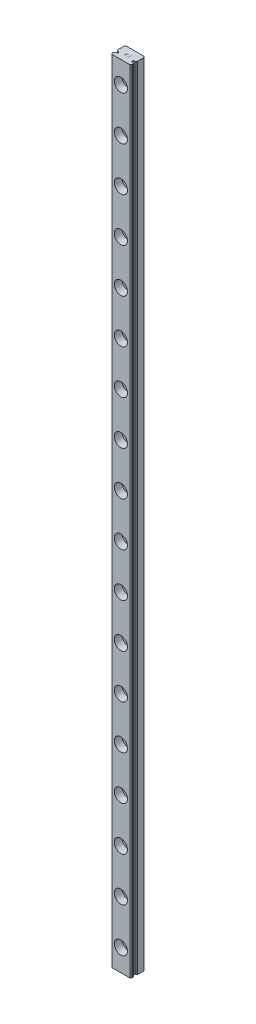
from build123d import *

# Parameters (mm, degrees)
SALIENTE_EXTRUIR1_DEPTH               = 360
CORTAR_EXTRUIR1_DEPTH                 = 361.086795093
CORTAR_EXTRUIR2_DEPTH                 = 361.086795093
CORTAR_EXTRUIR3_DEPTH                 = 361.086795093
CORTAR_EXTRUIR4_DEPTH                 = 361.086795093
CORTAR_EXTRUIR5_DEPTH                 = 361.086795093
CORTAR_EXTRUIR6_DEPTH                 = 361.086795093
CORTAR_EXTRUIR7_DEPTH                 = 0.002166667
CORTAR_EXTRUIR8_DEPTH                 = 0.002166667
CORTAR_EXTRUIR9_DEPTH                 = 0.002166667
CORTAR_EXTRUIR10_DEPTH                = 0.002166667
NGULO_DE_SALIDA1_ANGLE                = 45.1469538
TALADRO_ROSCADO_M3_5X0_61_AT_2_COUNT  = 2
TALADRO_ROSCADO_M3_5X0_61_AT_2_PITCH  = 20
TALADRO_ROSCADO_M3_5X0_61_AT_3_COUNT  = 2
TALADRO_ROSCADO_M3_5X0_61_AT_3_PITCH  = 40
TALADRO_ROSCADO_M3_5X0_61_AT_4_COUNT  = 2
TALADRO_ROSCADO_M3_5X0_61_AT_4_PITCH  = 60
TALADRO_ROSCADO_M3_5X0_61_AT_5_COUNT  = 2
TALADRO_ROSCADO_M3_5X0_61_AT_5_PITCH  = 80
TALADRO_ROSCADO_M3_5X0_61_AT_6_COUNT  = 2
TALADRO_ROSCADO_M3_5X0_61_AT_6_PITCH  = 100
TALADRO_ROSCADO_M3_5X0_61_AT_7_COUNT  = 2
TALADRO_ROSCADO_M3_5X0_61_AT_7_PITCH  = 120
TALADRO_ROSCADO_M3_5X0_61_AT_8_COUNT  = 2
TALADRO_ROSCADO_M3_5X0_61_AT_8_PITCH  = 140
TALADRO_ROSCADO_M3_5X0_61_AT_9_COUNT  = 2
TALADRO_ROSCADO_M3_5X0_61_AT_9_PITCH  = 160
TALADRO_ROSCADO_M3_5X0_61_AT_10_COUNT = 2
TALADRO_ROSCADO_M3_5X0_61_AT_10_PITCH = 180
TALADRO_ROSCADO_M3_5X0_61_AT_11_COUNT = 2
TALADRO_ROSCADO_M3_5X0_61_AT_11_PITCH = 200
TALADRO_ROSCADO_M3_5X0_61_AT_12_COUNT = 2
TALADRO_ROSCADO_M3_5X0_61_AT_12_PITCH = 220
TALADRO_ROSCADO_M3_5X0_61_AT_13_COUNT = 2
TALADRO_ROSCADO_M3_5X0_61_AT_13_PITCH = 240
TALADRO_ROSCADO_M3_5X0_61_AT_14_COUNT = 2
TALADRO_ROSCADO_M3_5X0_61_AT_14_PITCH = 260
TALADRO_ROSCADO_M3_5X0_61_AT_15_COUNT = 2
TALADRO_ROSCADO_M3_5X0_61_AT_15_PITCH = 280
TALADRO_ROSCADO_M3_5X0_61_AT_16_COUNT = 2
TALADRO_ROSCADO_M3_5X0_61_AT_16_PITCH = 300
TALADRO_ROSCADO_M3_5X0_61_AT_17_COUNT = 2
TALADRO_ROSCADO_M3_5X0_61_AT_17_PITCH = 320
TALADRO_ROSCADO_M3_5X0_61_AT_18_COUNT = 2
TALADRO_ROSCADO_M3_5X0_61_AT_18_PITCH = 20
CHAFL_N1_SIZE                         = 0.4
REDONDEO1_R                           = 0.130000023
CUT_EXTRUDE1_START                    = -3
SKETCH1_R                             = 3
CUT_EXTRUDE1_DEPTH                    = 3


with BuildPart() as part:
    # Croquis1 → Saliente-Extruir1 (new body)
    with BuildSketch(Plane.XZ):
        Polygon((4.5, 0), (4.5, 6.01167813), (4.1, 6.50000002), (-4.1, 6.50000002), (-4.5, 6.01167813), (-4.5, 0), align=None)
    extrude(amount=-SALIENTE_EXTRUIR1_DEPTH)

    # Croquis2 → Cortar-Extruir1 (cut, through all)
    with BuildSketch(Plane(origin=(0, 360, 0), x_dir=(-1, 0, 0), z_dir=(0, 1, 0))):
        with BuildLine():
            Line((-4.5, 4.88017535), (-4.5, 4.03150278))
            Line((-4.5, 4.03150278), (-3.819258765, 4.03150278))
            ThreePointArc((-3.819258765, 4.03150278), (-3.21946318, 4.455839065), (-3.819258765, 4.88017535))
            Line((-3.819258765, 4.88017535), (-4.5, 4.88017535))
        make_face()
    extrude(amount=-CORTAR_EXTRUIR1_DEPTH, mode=Mode.SUBTRACT)

    # Croquis3 → Cortar-Extruir2 (cut, through all)
    with BuildSketch(Plane(origin=(0, 360, 0), x_dir=(-1, 0, 0), z_dir=(0, 1, 0))):
        with BuildLine():
            Line((-4.026513856, 4.03150278), (-4.5, 4.03150278))
            Line((-4.5, 4.03150278), (-4.5, 3.583620931))
            ThreePointArc((-4.5, 3.583620931), (-4.223645982, 3.76568645), (-4.026513856, 4.03150278))
        make_face()
    extrude(amount=-CORTAR_EXTRUIR2_DEPTH, mode=Mode.SUBTRACT)

    # Croquis4 → Cortar-Extruir3 (cut, through all)
    with BuildSketch(Plane(origin=(0, 360, 0), x_dir=(-1, 0, 0), z_dir=(0, 1, 0))):
        with BuildLine():
            Line((-4.5, 5.328056964), (-4.5, 4.88017535))
            Line((-4.5, 4.88017535), (-4.026513974, 4.88017535))
            ThreePointArc((-4.026513974, 4.88017535), (-4.223646078, 5.145991535), (-4.5, 5.328056964))
        make_face()
    extrude(amount=-CORTAR_EXTRUIR3_DEPTH, mode=Mode.SUBTRACT)

    # Croquis5 → Cortar-Extruir4 (cut, through all)
    with BuildSketch(Plane(origin=(0, 360, 0), x_dir=(-1, 0, 0), z_dir=(0, 1, 0))):
        with BuildLine():
            Line((4.5, 4.03150278), (4.5, 4.88017535))
            Line((4.5, 4.88017535), (3.819258765, 4.88017535))
            ThreePointArc((3.819258765, 4.88017535), (3.21946318, 4.455839065), (3.819258765, 4.03150278))
            Line((3.819258765, 4.03150278), (4.5, 4.03150278))
        make_face()
    extrude(amount=-CORTAR_EXTRUIR4_DEPTH, mode=Mode.SUBTRACT)

    # Croquis6 → Cortar-Extruir5 (cut, through all)
    with BuildSketch(Plane(origin=(0, 360, 0), x_dir=(-1, 0, 0), z_dir=(0, 1, 0))):
        with BuildLine():
            Line((4.026513826, 4.88017535), (4.5, 4.88017535))
            Line((4.5, 4.88017535), (4.5, 5.328057255))
            ThreePointArc((4.5, 5.328057255), (4.223645966, 5.145991706), (4.026513826, 4.88017535))
        make_face()
    extrude(amount=-CORTAR_EXTRUIR5_DEPTH, mode=Mode.SUBTRACT)

    # Croquis7 → Cortar-Extruir6 (cut, through all)
    with BuildSketch(Plane(origin=(0, 360, 0), x_dir=(-1, 0, 0), z_dir=(0, 1, 0))):
        with BuildLine():
            Line((4.5, 3.583620926), (4.5, 4.03150278))
            Line((4.5, 4.03150278), (4.026513851, 4.03150278))
            ThreePointArc((4.026513851, 4.03150278), (4.223645987, 3.765686455), (4.5, 3.583620926))
        make_face()
    extrude(amount=-CORTAR_EXTRUIR6_DEPTH, mode=Mode.SUBTRACT)

    # Croquis8 → Cortar-Extruir7 (cut)
    with BuildSketch(Plane(origin=(0, 360, 0), x_dir=(-1, 0, 0), z_dir=(0, 1, 0))):
        Polygon((0.891369267, 3.403698133), (0.714701433, 3.168235633), (0.2187042, 2.61105), (1.0945792, 2.61105), (1.0945792, 2.695983333), (0.398689633, 2.695983333), (0.794326433, 3.149466667), (0.9743123, 3.3891), (1.067110588, 3.573407857), (0.95413722, 3.802321701), (0.7876908, 3.88505), (0.54301, 3.88505), (0.375434678, 3.803592619), (0.295011167, 3.6384023), (0.295011167, 3.562), (0.3812718, 3.562), (0.3812718, 3.631766667), (0.437672733, 3.743620833), (0.549645633, 3.800116667), (0.7802262, 3.800116667), (0.893028067, 3.743810633), (0.976240026, 3.576039029), align=None)
    extrude(amount=-CORTAR_EXTRUIR7_DEPTH, mode=Mode.SUBTRACT)

    # Croquis9 → Cortar-Extruir8 (cut)
    with BuildSketch(Plane.XZ):
        Polygon((-0.214632167, 3.88505), (-0.953983333, 3.88505), (-0.953983333, 2.61105), (-0.214632167, 2.61105), (-0.214632167, 2.695983333), (-0.86905, 2.695983333), (-0.86905, 3.205583333), (-0.5123963, 3.205583333), (-0.5123963, 3.290516667), (-0.86905, 3.290516667), (-0.86905, 3.800116667), (-0.214632167, 3.800116667), align=None)
    extrude(amount=-CORTAR_EXTRUIR8_DEPTH, mode=Mode.SUBTRACT)

    # Croquis10 → Cortar-Extruir9 (cut)
    with BuildSketch(Plane(origin=(0, 360, 0), x_dir=(-1, 0, 0), z_dir=(0, 1, 0))):
        Polygon((-0.214632167, 3.88505), (-0.953983333, 3.88505), (-0.953983333, 2.61105), (-0.214632167, 2.61105), (-0.214632167, 2.695983333), (-0.86905, 2.695983333), (-0.86905, 3.205583333), (-0.5123963, 3.205583333), (-0.5123963, 3.290516667), (-0.86905, 3.290516667), (-0.86905, 3.800116667), (-0.214632167, 3.800116667), align=None)
    extrude(amount=-CORTAR_EXTRUIR9_DEPTH, mode=Mode.SUBTRACT)

    # Croquis11 → Cortar-Extruir10 (cut)
    with BuildSketch(Plane.XZ):
        Polygon((0.510057167, 3.620830633), (0.6071, 3.718655633), (0.6071, 2.609403333), (0.692033333, 2.609403333), (0.692033333, 3.883403333), (0.6741176, 3.883403333), (0.6741176, 3.795069794), (0.3690544, 3.640736667), (0.3690544, 3.551253333), align=None)
    extrude(amount=-CORTAR_EXTRUIR10_DEPTH, mode=Mode.SUBTRACT)

    # Ángulo de salida1
    ngulo_de_salida1_faces = [part.faces().sort_by_distance(p)[0] for p in [
        (0.6741176, 0.001083333, 3.839236564),
    ]]
    draft(ngulo_de_salida1_faces, Plane(origin=(0.692033333, 0.002166667, 3.883403333), x_dir=(-1, 0, 0), z_dir=(0, 0, -1)), NGULO_DE_SALIDA1_ANGLE)

    # Croquis34 → Taladro roscado M3.5x0.61 (revolve, cut)
    with BuildSketch(Plane(origin=(0, 330, 0), x_dir=(0, 1, 0), z_dir=(1, 0, 0))):
        Polygon((0, 0), (0, 6.09), (3, 6.09), (3, 3), (1.75, 3), (1.75, 0), align=None)
    taladro_roscado_m3_5x0_61 = revolve(axis=Axis((0, 330, -6.35), (0, 0, 1)), mode=Mode.SUBTRACT)

    # Taladro roscado M3.5x0.61 at 2: Taladro roscado M3.5x0.61 ×2
    with Locations(*[(0, -i * TALADRO_ROSCADO_M3_5X0_61_AT_2_PITCH, 0) for i in range(1, TALADRO_ROSCADO_M3_5X0_61_AT_2_COUNT)]):
        add(taladro_roscado_m3_5x0_61, mode=Mode.SUBTRACT)

    # Taladro roscado M3.5x0.61 at 3: Taladro roscado M3.5x0.61 ×2
    with Locations(*[(0, -i * TALADRO_ROSCADO_M3_5X0_61_AT_3_PITCH, 0) for i in range(1, TALADRO_ROSCADO_M3_5X0_61_AT_3_COUNT)]):
        add(taladro_roscado_m3_5x0_61, mode=Mode.SUBTRACT)

    # Taladro roscado M3.5x0.61 at 4: Taladro roscado M3.5x0.61 ×2
    with Locations(*[(0, -i * TALADRO_ROSCADO_M3_5X0_61_AT_4_PITCH, 0) for i in range(1, TALADRO_ROSCADO_M3_5X0_61_AT_4_COUNT)]):
        add(taladro_roscado_m3_5x0_61, mode=Mode.SUBTRACT)

    # Taladro roscado M3.5x0.61 at 5: Taladro roscado M3.5x0.61 ×2
    with Locations(*[(0, -i * TALADRO_ROSCADO_M3_5X0_61_AT_5_PITCH, 0) for i in range(1, TALADRO_ROSCADO_M3_5X0_61_AT_5_COUNT)]):
        add(taladro_roscado_m3_5x0_61, mode=Mode.SUBTRACT)

    # Taladro roscado M3.5x0.61 at 6: Taladro roscado M3.5x0.61 ×2
    with Locations(*[(0, -i * TALADRO_ROSCADO_M3_5X0_61_AT_6_PITCH, 0) for i in range(1, TALADRO_ROSCADO_M3_5X0_61_AT_6_COUNT)]):
        add(taladro_roscado_m3_5x0_61, mode=Mode.SUBTRACT)

    # Taladro roscado M3.5x0.61 at 7: Taladro roscado M3.5x0.61 ×2
    with Locations(*[(0, -i * TALADRO_ROSCADO_M3_5X0_61_AT_7_PITCH, 0) for i in range(1, TALADRO_ROSCADO_M3_5X0_61_AT_7_COUNT)]):
        add(taladro_roscado_m3_5x0_61, mode=Mode.SUBTRACT)

    # Taladro roscado M3.5x0.61 at 8: Taladro roscado M3.5x0.61 ×2
    with Locations(*[(0, -i * TALADRO_ROSCADO_M3_5X0_61_AT_8_PITCH, 0) for i in range(1, TALADRO_ROSCADO_M3_5X0_61_AT_8_COUNT)]):
        add(taladro_roscado_m3_5x0_61, mode=Mode.SUBTRACT)

    # Taladro roscado M3.5x0.61 at 9: Taladro roscado M3.5x0.61 ×2
    with Locations(*[(0, -i * TALADRO_ROSCADO_M3_5X0_61_AT_9_PITCH, 0) for i in range(1, TALADRO_ROSCADO_M3_5X0_61_AT_9_COUNT)]):
        add(taladro_roscado_m3_5x0_61, mode=Mode.SUBTRACT)

    # Taladro roscado M3.5x0.61 at 10: Taladro roscado M3.5x0.61 ×2
    with Locations(*[(0, -i * TALADRO_ROSCADO_M3_5X0_61_AT_10_PITCH, 0) for i in range(1, TALADRO_ROSCADO_M3_5X0_61_AT_10_COUNT)]):
        add(taladro_roscado_m3_5x0_61, mode=Mode.SUBTRACT)

    # Taladro roscado M3.5x0.61 at 11: Taladro roscado M3.5x0.61 ×2
    with Locations(*[(0, -i * TALADRO_ROSCADO_M3_5X0_61_AT_11_PITCH, 0) for i in range(1, TALADRO_ROSCADO_M3_5X0_61_AT_11_COUNT)]):
        add(taladro_roscado_m3_5x0_61, mode=Mode.SUBTRACT)

    # Taladro roscado M3.5x0.61 at 12: Taladro roscado M3.5x0.61 ×2
    with Locations(*[(0, -i * TALADRO_ROSCADO_M3_5X0_61_AT_12_PITCH, 0) for i in range(1, TALADRO_ROSCADO_M3_5X0_61_AT_12_COUNT)]):
        add(taladro_roscado_m3_5x0_61, mode=Mode.SUBTRACT)

    # Taladro roscado M3.5x0.61 at 13: Taladro roscado M3.5x0.61 ×2
    with Locations(*[(0, -i * TALADRO_ROSCADO_M3_5X0_61_AT_13_PITCH, 0) for i in range(1, TALADRO_ROSCADO_M3_5X0_61_AT_13_COUNT)]):
        add(taladro_roscado_m3_5x0_61, mode=Mode.SUBTRACT)

    # Taladro roscado M3.5x0.61 at 14: Taladro roscado M3.5x0.61 ×2
    with Locations(*[(0, -i * TALADRO_ROSCADO_M3_5X0_61_AT_14_PITCH, 0) for i in range(1, TALADRO_ROSCADO_M3_5X0_61_AT_14_COUNT)]):
        add(taladro_roscado_m3_5x0_61, mode=Mode.SUBTRACT)

    # Taladro roscado M3.5x0.61 at 15: Taladro roscado M3.5x0.61 ×2
    with Locations(*[(0, -i * TALADRO_ROSCADO_M3_5X0_61_AT_15_PITCH, 0) for i in range(1, TALADRO_ROSCADO_M3_5X0_61_AT_15_COUNT)]):
        add(taladro_roscado_m3_5x0_61, mode=Mode.SUBTRACT)

    # Taladro roscado M3.5x0.61 at 16: Taladro roscado M3.5x0.61 ×2
    with Locations(*[(0, -i * TALADRO_ROSCADO_M3_5X0_61_AT_16_PITCH, 0) for i in range(1, TALADRO_ROSCADO_M3_5X0_61_AT_16_COUNT)]):
        add(taladro_roscado_m3_5x0_61, mode=Mode.SUBTRACT)

    # Taladro roscado M3.5x0.61 at 17: Taladro roscado M3.5x0.61 ×2
    with Locations(*[(0, -i * TALADRO_ROSCADO_M3_5X0_61_AT_17_PITCH, 0) for i in range(1, TALADRO_ROSCADO_M3_5X0_61_AT_17_COUNT)]):
        add(taladro_roscado_m3_5x0_61, mode=Mode.SUBTRACT)

    # Taladro roscado M3.5x0.61 at 18: Taladro roscado M3.5x0.61 ×2
    with Locations(*[(0, i * TALADRO_ROSCADO_M3_5X0_61_AT_18_PITCH, 0) for i in range(1, TALADRO_ROSCADO_M3_5X0_61_AT_18_COUNT)]):
        add(taladro_roscado_m3_5x0_61, mode=Mode.SUBTRACT)

    # Chaflán1
    chafl_n1_edges = [part.edges().sort_by_distance(p)[0] for p in [
        (-4.5, 180, 0),
        (4.5, 180, 0),
    ]]
    chamfer(chafl_n1_edges, length=CHAFL_N1_SIZE)

    # Redondeo1
    redondeo1_edges = [part.edges().sort_by_distance(p)[0] for p in [
        (4.026513856, 180, 4.03150278),
        (4.5, 180, 3.583620931),
        (4.5, 180, 5.328056964),
        (4.026513974, 180, 4.88017535),
        (-4.026513826, 180, 4.88017535),
        (-4.5, 180, 5.328057255),
        (-4.5, 180, 3.583620926),
        (-4.026513851, 180, 4.03150278),
    ]]
    fillet(redondeo1_edges, radius=REDONDEO1_R)

    # Sketch1 → Cut-Extrude1 (cut)
    with BuildSketch(Plane.XY.offset(6.50000002).offset(CUT_EXTRUDE1_START)):
        with Locations(Location((0, 10, 0), (0, 0, 180))):
            Circle(SKETCH1_R)
        with Locations(Location((0, 30, 0), (0, 0, 180))):
            Circle(SKETCH1_R)
        with Locations(Location((0, 50, 0), (0, 0, 180))):
            Circle(SKETCH1_R)
        with Locations(Location((0, 70, 0), (0, 0, 180))):
            Circle(SKETCH1_R)
        with Locations(Location((0, 90, 0), (0, 0, 180))):
            Circle(SKETCH1_R)
        with Locations(Location((0, 110, 0), (0, 0, 180))):
            Circle(SKETCH1_R)
        with Locations(Location((0, 130, 0), (0, 0, 180))):
            Circle(SKETCH1_R)
        with Locations(Location((0, 150, 0), (0, 0, 180))):
            Circle(SKETCH1_R)
        with Locations(Location((0, 170, 0), (0, 0, 180))):
            Circle(SKETCH1_R)
        with Locations(Location((0, 190, 0), (0, 0, 180))):
            Circle(SKETCH1_R)
        with Locations(Location((0, 210, 0), (0, 0, 180))):
            Circle(SKETCH1_R)
        with Locations(Location((0, 230, 0), (0, 0, 180))):
            Circle(SKETCH1_R)
        with Locations(Location((0, 250, 0), (0, 0, 180))):
            Circle(SKETCH1_R)
        with Locations(Location((0, 270, 0), (0, 0, 180))):
            Circle(SKETCH1_R)
        with Locations(Location((0, 290, 0), (0, 0, 180))):
            Circle(SKETCH1_R)
        with Locations(Location((0, 310, 0), (0, 0, 180))):
            Circle(SKETCH1_R)
        with Locations(Location((0, 330, 0), (0, 0, 180))):
            Circle(SKETCH1_R)
        with Locations(Location((0, 350, 0), (0, 0, 180))):
            Circle(SKETCH1_R)
    extrude(amount=CUT_EXTRUDE1_DEPTH, mode=Mode.SUBTRACT)


solid = part.part
